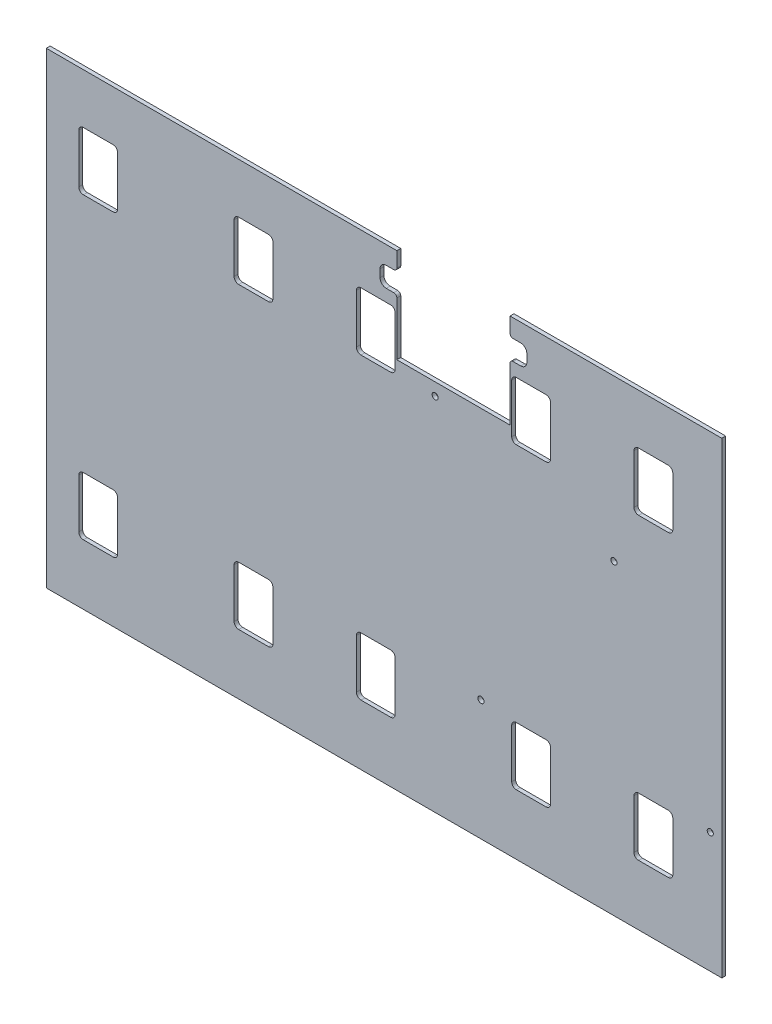
from build123d import *

# Parameters (mm, degrees)
SKETCH1_W           = 441.979400076
SKETCH1_H           = 305.81676
BOSS_EXTRUDE1_DEPTH = 2.54
CUT_EXTRUDE1_DEPTH  = 271.648139079
LPATTERN1_COUNT     = 3
LPATTERN1_PITCH     = 181.613999992
CUT_EXTRUDE2_DEPTH  = 271.648139079
LPATTERN2_COUNT     = 2
LPATTERN2_PITCH     = 181.613999992
CUT_EXTRUDE3_DEPTH  = 271.648139079
SKETCH6_R           = 2
CUT_EXTRUDE4_DEPTH  = 271.648139079


with BuildPart() as part:
    # Sketch1 → Boss-Extrude1 (new body)
    # profile 1 of 5: a face of its own
    with BuildSketch(Plane.XY):
        with Locations((0, -3.32067)):
            Rectangle(SKETCH1_W, SKETCH1_H)
        with BuildLine():
            ThreePointArc((-98.112625, -113.8), (-97.233945344, -115.921320344), (-95.112625, -116.8))
            Line((-95.112625, -116.8), (-75.712625, -116.8))
            ThreePointArc((-75.712625, -116.8), (-73.591304656, -115.921320344), (-72.712625, -113.8))
            Line((-72.712625, -113.8), (-72.712625, -81.7))
            ThreePointArc((-72.712625, -81.7), (-73.591304656, -79.578679656), (-75.712625, -78.7))
            Line((-75.712625, -78.7), (-95.112625, -78.7))
            ThreePointArc((-95.112625, -78.7), (-97.233945344, -79.578679656), (-98.112625, -81.7))
            Line((-98.112625, -81.7), (-98.112625, -113.8))
        make_face(mode=Mode.SUBTRACT)
        with BuildLine():
            ThreePointArc((-98.112625, 81.7), (-97.233945344, 79.578679656), (-95.112625, 78.7))
            Line((-95.112625, 78.7), (-75.712625, 78.7))
            ThreePointArc((-75.712625, 78.7), (-73.591304656, 79.578679656), (-72.712625, 81.7))
            Line((-72.712625, 81.7), (-72.712625, 113.8))
            ThreePointArc((-72.712625, 113.8), (-73.591304656, 115.921320344), (-75.712625, 116.8))
            Line((-75.712625, 116.8), (-95.112625, 116.8))
            ThreePointArc((-95.112625, 116.8), (-97.233945344, 115.921320344), (-98.112625, 113.8))
            Line((-98.112625, 113.8), (-98.112625, 81.7))
        make_face(mode=Mode.SUBTRACT)
        with BuildLine():
            ThreePointArc((-199.715375, -113.8), (-198.836695344, -115.921320344), (-196.715375, -116.8))
            Line((-196.715375, -116.8), (-177.315375, -116.8))
            ThreePointArc((-177.315375, -116.8), (-175.194054656, -115.921320344), (-174.315375, -113.8))
            Line((-174.315375, -113.8), (-174.315375, -81.7))
            ThreePointArc((-174.315375, -81.7), (-175.194054656, -79.578679656), (-177.315375, -78.7))
            Line((-177.315375, -78.7), (-196.715375, -78.7))
            ThreePointArc((-196.715375, -78.7), (-198.836695344, -79.578679656), (-199.715375, -81.7))
            Line((-199.715375, -81.7), (-199.715375, -113.8))
        make_face(mode=Mode.SUBTRACT)
        with BuildLine():
            ThreePointArc((-199.715375, 81.7), (-198.836695344, 79.578679656), (-196.715375, 78.7))
            Line((-196.715375, 78.7), (-177.315375, 78.7))
            ThreePointArc((-177.315375, 78.7), (-175.194054656, 79.578679656), (-174.315375, 81.7))
            Line((-174.315375, 81.7), (-174.315375, 113.8))
            ThreePointArc((-174.315375, 113.8), (-175.194054656, 115.921320344), (-177.315375, 116.8))
            Line((-177.315375, 116.8), (-196.715375, 116.8))
            ThreePointArc((-196.715375, 116.8), (-198.836695344, 115.921320344), (-199.715375, 113.8))
            Line((-199.715375, 113.8), (-199.715375, 81.7))
        make_face(mode=Mode.SUBTRACT)
    # profile 2 of 5: a face of its own
    with BuildSketch(Plane.XY):
        with BuildLine():
            Line((-199.715375, -113.8), (-199.715375, -81.7))
            ThreePointArc((-199.715375, -81.7), (-198.836695344, -79.578679656), (-196.715375, -78.7))
            Line((-196.715375, -78.7), (-177.315375, -78.7))
            ThreePointArc((-177.315375, -78.7), (-175.194054656, -79.578679656), (-174.315375, -81.7))
            Line((-174.315375, -81.7), (-174.315375, -113.8))
            ThreePointArc((-174.315375, -113.8), (-175.194054656, -115.921320344), (-177.315375, -116.8))
            Line((-177.315375, -116.8), (-196.715375, -116.8))
            ThreePointArc((-196.715375, -116.8), (-198.836695344, -115.921320344), (-199.715375, -113.8))
        make_face()
    # profile 3 of 5: a face of its own
    with BuildSketch(Plane.XY):
        with BuildLine():
            Line((-98.112625, -113.8), (-98.112625, -81.7))
            ThreePointArc((-98.112625, -81.7), (-97.233945344, -79.578679656), (-95.112625, -78.7))
            Line((-95.112625, -78.7), (-75.712625, -78.7))
            ThreePointArc((-75.712625, -78.7), (-73.591304656, -79.578679656), (-72.712625, -81.7))
            Line((-72.712625, -81.7), (-72.712625, -113.8))
            ThreePointArc((-72.712625, -113.8), (-73.591304656, -115.921320344), (-75.712625, -116.8))
            Line((-75.712625, -116.8), (-95.112625, -116.8))
            ThreePointArc((-95.112625, -116.8), (-97.233945344, -115.921320344), (-98.112625, -113.8))
        make_face()
    # profile 4 of 5: a face of its own
    with BuildSketch(Plane.XY):
        with BuildLine():
            Line((-199.715375, 113.8), (-199.715375, 81.7))
            ThreePointArc((-199.715375, 81.7), (-198.836695344, 79.578679656), (-196.715375, 78.7))
            Line((-196.715375, 78.7), (-177.315375, 78.7))
            ThreePointArc((-177.315375, 78.7), (-175.194054656, 79.578679656), (-174.315375, 81.7))
            Line((-174.315375, 81.7), (-174.315375, 113.8))
            ThreePointArc((-174.315375, 113.8), (-175.194054656, 115.921320344), (-177.315375, 116.8))
            Line((-177.315375, 116.8), (-196.715375, 116.8))
            ThreePointArc((-196.715375, 116.8), (-198.836695344, 115.921320344), (-199.715375, 113.8))
        make_face()
    # profile 5 of 5: a face of its own
    with BuildSketch(Plane.XY):
        with BuildLine():
            Line((-98.112625, 113.8), (-98.112625, 81.7))
            ThreePointArc((-98.112625, 81.7), (-97.233945344, 79.578679656), (-95.112625, 78.7))
            Line((-95.112625, 78.7), (-75.712625, 78.7))
            ThreePointArc((-75.712625, 78.7), (-73.591304656, 79.578679656), (-72.712625, 81.7))
            Line((-72.712625, 81.7), (-72.712625, 113.8))
            ThreePointArc((-72.712625, 113.8), (-73.591304656, 115.921320344), (-75.712625, 116.8))
            Line((-75.712625, 116.8), (-95.112625, 116.8))
            ThreePointArc((-95.112625, 116.8), (-97.233945344, 115.921320344), (-98.112625, 113.8))
        make_face()
    extrude(amount=BOSS_EXTRUDE1_DEPTH)

    # Sketch2 → Cut-Extrude1 (cut, through all)
    with BuildSketch(Plane.XY.offset(2.54)):
        with BuildLine():
            Line((-196.715375, 78.7), (-177.315375, 78.7))
            ThreePointArc((-177.315375, 78.7), (-175.194054656, 79.578679656), (-174.315375, 81.7))
            Line((-174.315375, 81.7), (-174.315375, 113.8))
            ThreePointArc((-174.315375, 113.8), (-175.194054656, 115.921320344), (-177.315375, 116.8))
            Line((-177.315375, 116.8), (-196.715375, 116.8))
            ThreePointArc((-196.715375, 116.8), (-198.836695344, 115.921320344), (-199.715375, 113.8))
            Line((-199.715375, 113.8), (-199.715375, 81.7))
            ThreePointArc((-199.715375, 81.7), (-198.836695344, 79.578679656), (-196.715375, 78.7))
        make_face()
        with BuildLine():
            Line((-199.715375, -81.7), (-199.715375, -113.8))
            ThreePointArc((-199.715375, -113.8), (-198.836695344, -115.921320344), (-196.715375, -116.8))
            Line((-196.715375, -116.8), (-177.315375, -116.8))
            ThreePointArc((-177.315375, -116.8), (-175.194054656, -115.921320344), (-174.315375, -113.8))
            Line((-174.315375, -113.8), (-174.315375, -81.7))
            ThreePointArc((-174.315375, -81.7), (-175.194054656, -79.578679656), (-177.315375, -78.7))
            Line((-177.315375, -78.7), (-196.715375, -78.7))
            ThreePointArc((-196.715375, -78.7), (-198.836695344, -79.578679656), (-199.715375, -81.7))
        make_face()
    cut_extrude1 = extrude(amount=-CUT_EXTRUDE1_DEPTH, mode=Mode.SUBTRACT)

    # LPattern1: Cut-Extrude1 ×3
    with Locations(*[(i * LPATTERN1_PITCH, 0, 0) for i in range(1, LPATTERN1_COUNT)]):
        add(cut_extrude1, mode=Mode.SUBTRACT)

    # Sketch3 → Cut-Extrude2 (cut, through all)
    with BuildSketch(Plane.XY.offset(2.54)):
        with BuildLine():
            Line((-72.712625, 81.7), (-72.712625, 113.8))
            ThreePointArc((-72.712625, 113.8), (-73.591304656, 115.921320344), (-75.712625, 116.8))
            Line((-75.712625, 116.8), (-95.112625, 116.8))
            ThreePointArc((-95.112625, 116.8), (-97.233945344, 115.921320344), (-98.112625, 113.8))
            Line((-98.112625, 113.8), (-98.112625, 81.7))
            ThreePointArc((-98.112625, 81.7), (-97.233945344, 79.578679656), (-95.112625, 78.7))
            Line((-95.112625, 78.7), (-75.712625, 78.7))
            ThreePointArc((-75.712625, 78.7), (-73.591304656, 79.578679656), (-72.712625, 81.7))
        make_face()
        with BuildLine():
            Line((-72.712625, -113.8), (-72.712625, -81.7))
            ThreePointArc((-72.712625, -81.7), (-73.591304656, -79.578679656), (-75.712625, -78.7))
            Line((-75.712625, -78.7), (-95.112625, -78.7))
            ThreePointArc((-95.112625, -78.7), (-97.233945344, -79.578679656), (-98.112625, -81.7))
            Line((-98.112625, -81.7), (-98.112625, -113.8))
            ThreePointArc((-98.112625, -113.8), (-97.233945344, -115.921320344), (-95.112625, -116.8))
            Line((-95.112625, -116.8), (-75.712625, -116.8))
            ThreePointArc((-75.712625, -116.8), (-73.591304656, -115.921320344), (-72.712625, -113.8))
        make_face()
    cut_extrude2 = extrude(amount=-CUT_EXTRUDE2_DEPTH, mode=Mode.SUBTRACT)

    # LPattern2: Cut-Extrude2 ×2
    with Locations(*[(i * LPATTERN2_PITCH, 0, 0) for i in range(1, LPATTERN2_COUNT)]):
        add(cut_extrude2, mode=Mode.SUBTRACT)

    # Sketch5 → Cut-Extrude3 (cut, through all)
    with BuildSketch(Plane.XY.offset(2.54)):
        with BuildLine():
            ThreePointArc((8.383999992, 139.78771), (7.802899846, 138.384810146), (6.399999992, 137.80371))
            Line((6.399999992, 137.80371), (1.399999992, 137.80371))
            ThreePointArc((1.399999992, 137.80371), (-1.439740841, 136.627450833), (-2.616000008, 133.78771))
            Line((-2.616000008, 133.78771), (-2.616000008, 128.78771))
            ThreePointArc((-2.616000008, 128.78771), (-1.439740841, 125.947969167), (1.399999992, 124.77171))
            Line((1.399999992, 124.77171), (6.399999992, 124.77171))
            ThreePointArc((6.399999992, 124.77171), (7.802899846, 124.190609854), (8.383999992, 122.78771))
            Line((8.383999992, 122.78771), (8.383999992, 87.77171))
            Line((8.383999992, 87.77171), (82.415999992, 87.77171))
            Line((82.415999992, 87.77171), (82.415999992, 122.78771))
            ThreePointArc((82.415999992, 122.78771), (82.997100138, 124.190609854), (84.399999992, 124.77171))
            Line((84.399999992, 124.77171), (89.399999992, 124.77171))
            ThreePointArc((89.399999992, 124.77171), (92.239740825, 125.947969167), (93.415999992, 128.78771))
            Line((93.415999992, 128.78771), (93.415999992, 133.78771))
            ThreePointArc((93.415999992, 133.78771), (92.239740825, 136.627450833), (89.399999992, 137.80371))
            Line((89.399999992, 137.80371), (84.399999992, 137.80371))
            ThreePointArc((84.399999992, 137.80371), (82.997100138, 138.384810146), (82.415999992, 139.78771))
            Line((82.415999992, 139.78771), (82.415999992, 149.80371))
            Line((82.415999992, 149.80371), (8.383999992, 149.80371))
            Line((8.383999992, 149.80371), (8.383999992, 139.78771))
        make_face()
    extrude(amount=-CUT_EXTRUDE3_DEPTH, mode=Mode.SUBTRACT)

    # Sketch6 → Cut-Extrude4 (cut, through all)
    with BuildSketch(Plane.XY.offset(2.54)):
        with Locations((63.425, -77.41229)):
            Circle(SKETCH6_R)
        with Locations((213.425, -77.41229)):
            Circle(SKETCH6_R)
        with Locations((150.425, 44.58771)):
            Circle(SKETCH6_R)
        with Locations((33.425, 79.58771)):
            Circle(SKETCH6_R)
    extrude(amount=-CUT_EXTRUDE4_DEPTH, mode=Mode.SUBTRACT)


solid = part.part
